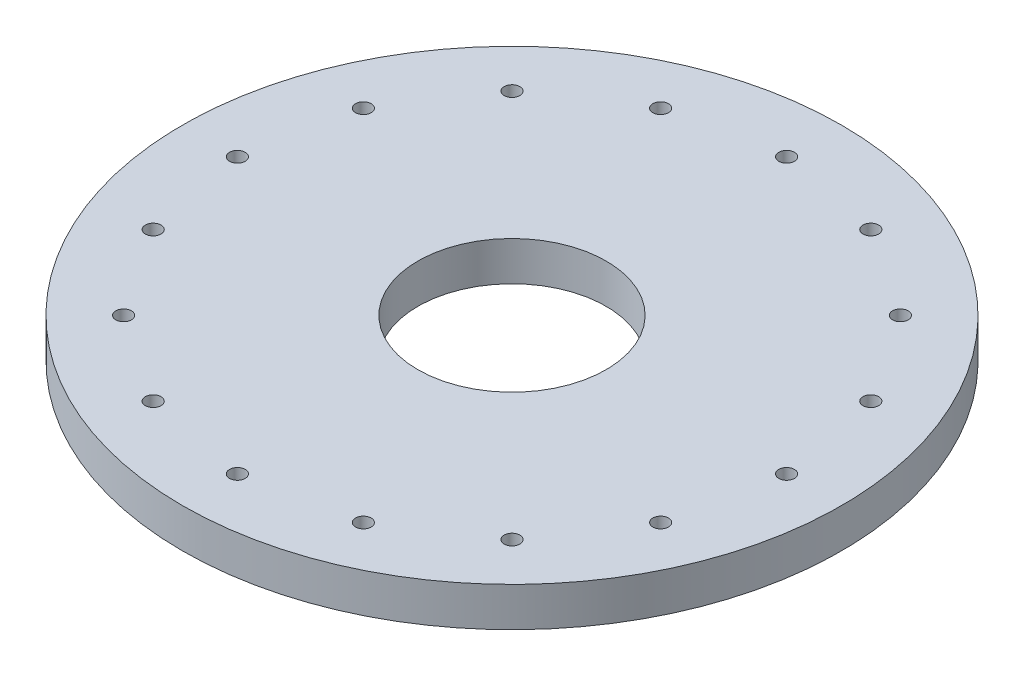
from build123d import *

# Parameters (mm, degrees)
SKETCH1_R           = 42
SKETCH1_R_2         = 12
SKETCH1_R_3         = 1
BOSS_EXTRUDE1_DEPTH = 5


with BuildPart() as part:
    # Sketch1 → Boss-Extrude1 (new body)
    with BuildSketch(Plane(origin=(0, 0, 0), x_dir=(1, 0, 0), z_dir=(0, 1, 0))):
        with Locations(Location((0, 0, 0), (0, 0, 270))):
            Circle(SKETCH1_R)
        with Locations(Location((0, 0, 0), (0, 0, 270))):
            Circle(SKETCH1_R_2, mode=Mode.SUBTRACT)
        with Locations(Location((35, 0, 0), (0, 0, 270))):
            Circle(SKETCH1_R_3, mode=Mode.SUBTRACT)
        with Locations(Location((32.335783638, -13.393920133, 0), (0, 0, 270))):
            Circle(SKETCH1_R_3, mode=Mode.SUBTRACT)
        with Locations(Location((24.748737342, -24.748737342, 0), (0, 0, 270))):
            Circle(SKETCH1_R_3, mode=Mode.SUBTRACT)
        with Locations(Location((13.393920133, -32.335783638, 0), (0, 0, 270))):
            Circle(SKETCH1_R_3, mode=Mode.SUBTRACT)
        with Locations(Location((0, -35, 0), (0, 0, 270))):
            Circle(SKETCH1_R_3, mode=Mode.SUBTRACT)
        with Locations(Location((-13.393920133, -32.335783638, 0), (0, 0, 270))):
            Circle(SKETCH1_R_3, mode=Mode.SUBTRACT)
        with Locations(Location((-24.748737342, -24.748737342, 0), (0, 0, 270))):
            Circle(SKETCH1_R_3, mode=Mode.SUBTRACT)
        with Locations(Location((-32.335783638, -13.393920133, 0), (0, 0, 270))):
            Circle(SKETCH1_R_3, mode=Mode.SUBTRACT)
        with Locations(Location((-35, 0, 0), (0, 0, 270))):
            Circle(SKETCH1_R_3, mode=Mode.SUBTRACT)
        with Locations(Location((-32.335783638, 13.393920133, 0), (0, 0, 270))):
            Circle(SKETCH1_R_3, mode=Mode.SUBTRACT)
        with Locations(Location((-24.748737342, 24.748737342, 0), (0, 0, 270))):
            Circle(SKETCH1_R_3, mode=Mode.SUBTRACT)
        with Locations(Location((-13.393920133, 32.335783638, 0), (0, 0, 270))):
            Circle(SKETCH1_R_3, mode=Mode.SUBTRACT)
        with Locations(Location((0, 35, 0), (0, 0, 270))):
            Circle(SKETCH1_R_3, mode=Mode.SUBTRACT)
        with Locations(Location((13.393920133, 32.335783638, 0), (0, 0, 270))):
            Circle(SKETCH1_R_3, mode=Mode.SUBTRACT)
        with Locations(Location((24.748737342, 24.748737342, 0), (0, 0, 270))):
            Circle(SKETCH1_R_3, mode=Mode.SUBTRACT)
        with Locations(Location((32.335783638, 13.393920133, 0), (0, 0, 270))):
            Circle(SKETCH1_R_3, mode=Mode.SUBTRACT)
    extrude(amount=BOSS_EXTRUDE1_DEPTH)


solid = part.part
